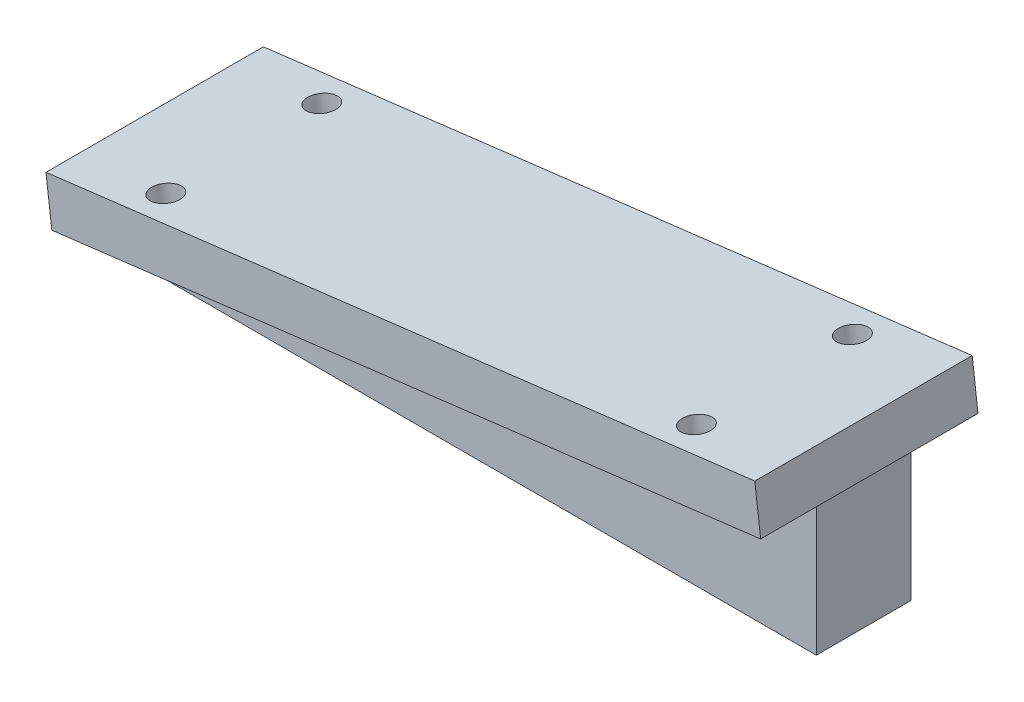
from build123d import *

# Parameters (mm, degrees)
SKETCH1_W           = 150
SKETCH1_H           = 20
BOSS_EXTRUDE1_DEPTH = 10
BOSS_EXTRUDE2_DEPTH = 10
BOSS_EXTRUDE3_DEPTH = 23
SKETCH6_R           = 3
CUT_EXTRUDE2_DEPTH  = 46


with BuildPart() as part:
    # Sketch1 → Boss-Extrude1 (new, symmetric)
    with BuildSketch(Plane(origin=(0, 0, 0), x_dir=(1, 0, 0), z_dir=(0, 1, 0))):
        Rectangle(SKETCH1_W, SKETCH1_H)
    extrude(amount=BOSS_EXTRUDE1_DEPTH, both=True)

    # Sketch2 → Boss-Extrude2 (add, symmetric)
    with BuildSketch(Plane.XY):
        Polygon((-75, 10), (75, 10), (75, 28.417684135), align=None)
    extrude(amount=BOSS_EXTRUDE2_DEPTH, both=True)

    # Sketch3 → Boss-Extrude3 (add, symmetric)
    with BuildSketch(Plane.XY):
        Polygon((75, 28.417684135), (-75, 10), (-73.772154391, 0), (76.227845609, 18.417684135), align=None)
    extrude(amount=BOSS_EXTRUDE3_DEPTH, both=True)

    # Sketch6 → Cut-Extrude2 (cut)
    with BuildSketch(Plane(origin=(-2.323519743, 18.923549716, 0), x_dir=(0.9925461516413229, 0.12186934340514101, 0), z_dir=(-0.12186934340514102, 0.992546151641323, 0))):
        with Locations(Location((-54.222267939, 16.5, 0), (0, 0, 180))):
            Circle(SKETCH6_R)
        with Locations(Location((58.90420588, 16.5, 0), (0, 0, 180))):
            Circle(SKETCH6_R)
        with Locations(Location((58.90420588, -16.5, 0), (0, 0, 180))):
            Circle(SKETCH6_R)
        with Locations(Location((-54.222267939, -16.5, 0), (0, 0, 180))):
            Circle(SKETCH6_R)
    extrude(amount=-CUT_EXTRUDE2_DEPTH, mode=Mode.SUBTRACT)


solid = part.part
